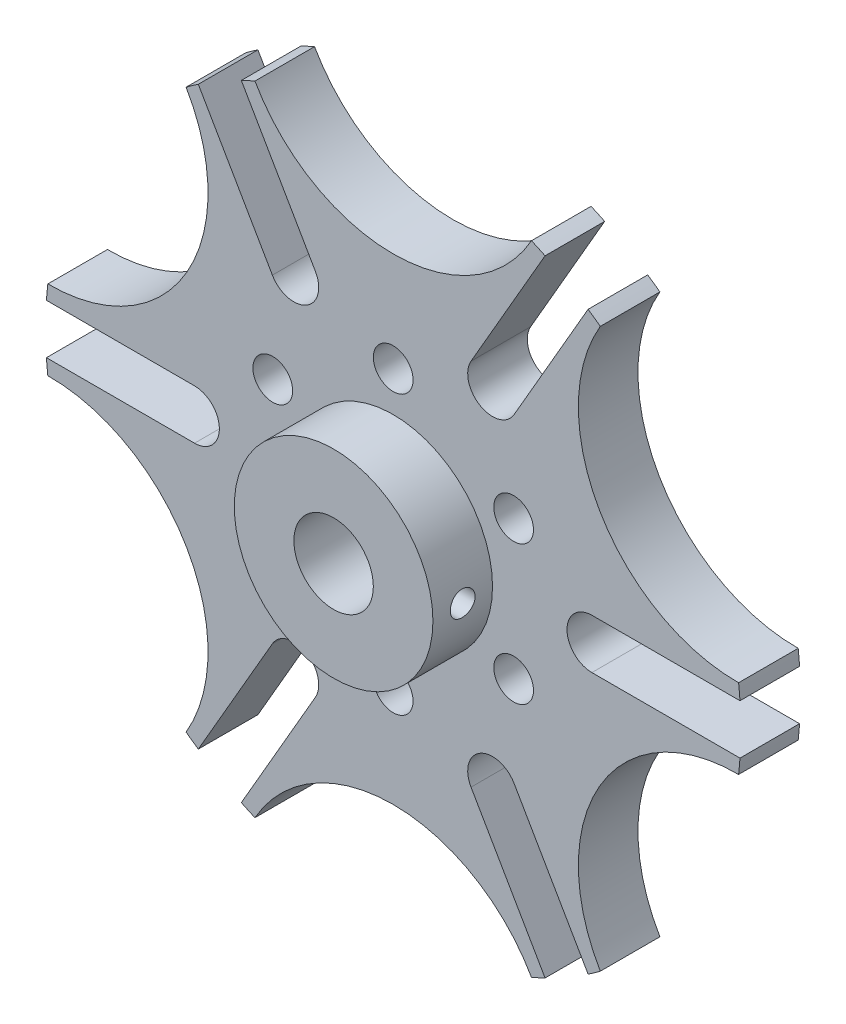
from build123d import *

# Parameters (mm, degrees)
SKETCH_1_R               = 70
EXTRUDE_1_DEPTH          = 12
SKETCH_2_R               = 20
EXTRUDE_2_DEPTH          = 12
SKETCH_3_R               = 8
CUT_EXTRUDE_1_DEPTH      = 102.862652626
CUT_EXTRUDE_2_DEPTH      = 102.862652626
PATTERN_CIRCULAR_1_COUNT = 6
SKETCH_5_R               = 32
CUT_EXTRUDE_3_DEPTH      = 141
PATTERN_CIRCULAR_2_COUNT = 6
SKETCH_6_R               = 4
CUT_EXTRUDE_4_DEPTH      = 140.642
SKETCH_8_R               = 2.5
CUT_EXTRUDE_7_DEPTH      = 13


with BuildPart() as part:
    # 草图1 → 凸台-拉伸1 (new body)
    with BuildSketch(Plane.XY):
        Circle(SKETCH_1_R)
    extrude(amount=EXTRUDE_1_DEPTH)

    # 草图2 → 凸台-拉伸2 (add)
    with BuildSketch(Plane.XY.offset(12)):
        Circle(SKETCH_2_R)
    extrude(amount=EXTRUDE_2_DEPTH)

    # 草图3 → 切除-拉伸1 (cut, through all)
    with BuildSketch(Plane.XY):
        Circle(SKETCH_3_R)
    extrude(amount=CUT_EXTRUDE_1_DEPTH, mode=Mode.SUBTRACT)

    # 草图4 → 切除-拉伸2 (cut, through all)
    with BuildSketch(Plane.XY):
        with BuildLine():
            Line((75, -5), (40, -5))
            ThreePointArc((40, -5), (35, 0), (40, 5))
            Line((40, 5), (75, 5))
            Line((75, 5), (75, -5))
        make_face()
    cut_extrude_2 = extrude(amount=CUT_EXTRUDE_2_DEPTH, mode=Mode.SUBTRACT)

    # 阵列(圆周)1: 切除-拉伸2 ×6 about axis
    pattern_circular_1_axis = Axis((0, 0, 25.2), (0, 0, -1))
    for i in range(1, PATTERN_CIRCULAR_1_COUNT):
        add(cut_extrude_2.rotate(pattern_circular_1_axis, i * 360 / PATTERN_CIRCULAR_1_COUNT), mode=Mode.SUBTRACT)

    # 草图5 → 切除-拉伸3 (cut, symmetric)
    with BuildSketch(Plane.XY):
        with Locations((69.282, 40)):
            Circle(SKETCH_5_R)
    cut_extrude_3 = extrude(amount=CUT_EXTRUDE_3_DEPTH, both=True, mode=Mode.SUBTRACT)

    # 阵列(圆周)2: 切除-拉伸3 ×6 about axis
    pattern_circular_2_axis = Axis((0, 0, 25.2), (0, 0, -1))
    for i in range(1, PATTERN_CIRCULAR_2_COUNT):
        add(cut_extrude_3.rotate(pattern_circular_2_axis, i * 360 / PATTERN_CIRCULAR_2_COUNT), mode=Mode.SUBTRACT)

    # 草图6 → 切除-拉伸4 (cut, symmetric)
    with BuildSketch(Plane.XY):
        with Locations((24.248711, 14)):
            Circle(SKETCH_6_R)
        with Locations((0, 28)):
            Circle(SKETCH_6_R)
        with Locations((-24.248711, 14)):
            Circle(SKETCH_6_R)
        with Locations((-24.248711, -14)):
            Circle(SKETCH_6_R)
        with Locations((0, -28)):
            Circle(SKETCH_6_R)
        with Locations((24.248711, -14)):
            Circle(SKETCH_6_R)
    extrude(amount=CUT_EXTRUDE_4_DEPTH, both=True, mode=Mode.SUBTRACT)

    # 草图8 → 切除-拉伸7 (cut)
    with BuildSketch(Plane(origin=(20, 0, 0), x_dir=(0, 0, -1), z_dir=(1, 0, 0))):
        with Locations((-18, 0)):
            Circle(SKETCH_8_R)
    extrude(amount=-CUT_EXTRUDE_7_DEPTH, mode=Mode.SUBTRACT)


solid = part.part
